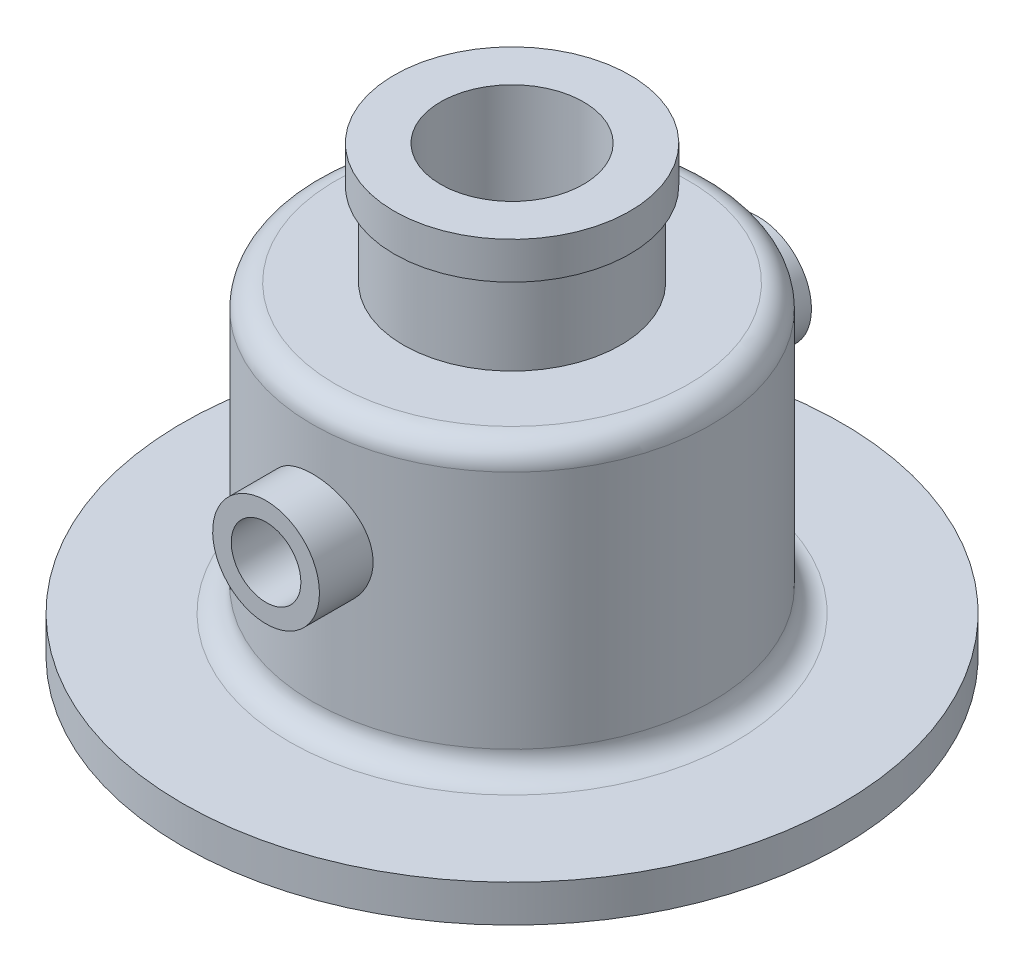
from build123d import *

# Parameters (mm, degrees)
BOSS_EXTRUDE1_START     = 35
SKETCH3_R               = 11.5
SKETCH3_R_2             = 7.5
BOSS_EXTRUDE1_DEPTH     = 18
BOSS_EXTRUDE2_START     = -53
SKETCH3_3_R             = 11.5
SKETCH3_3_R_2           = 7.5
BOSS_EXTRUDE2_DEPTH     = 18
CUT_EXTRUDE1_DEPTH      = 113.325965386
CUT_EXTRUDE1_DEPTH_BACK = 113.325965386
SKETCH3_4_R             = 7.5


with BuildPart() as part:
    # Sketch2 → Revolve1 (revolve)
    with BuildSketch(Plane.XY):
        with BuildLine():
            Line((32, -50.35), (32, -47.35))
            ThreePointArc((32, -47.35), (32.585786438, -45.935786438), (34, -45.35))
            Line((34, -45.35), (71, -45.35))
            Line((71, -45.35), (71, -37.35))
            Line((71, -37.35), (48, -37.35))
            ThreePointArc((48, -37.35), (44.464466094, -35.885533906), (43, -32.35))
            Line((43, -32.35), (43, 19.35))
            ThreePointArc((43, 19.35), (41.535533906, 22.885533906), (38, 24.35))
            Line((38, 24.35), (23.4, 24.35))
            Line((23.4, 24.35), (23.4, 42.35))
            Line((23.4, 42.35), (25.4, 42.35))
            Line((25.4, 42.35), (25.4, 50.35))
            Line((25.4, 50.35), (15.4, 50.35))
            Line((15.4, 50.35), (15.4, 16.197741963))
            Line((15.4, 16.197741963), (17.4, 13.774308272))
            Line((17.4, 13.774308272), (25.4, 13.774308272))
            Line((25.4, 13.774308272), (25.4, 17.62741804))
            Line((25.4, 17.62741804), (30, 17.62741804))
            ThreePointArc((30, 17.62741804), (33.535533906, 16.162951946), (35, 12.62741804))
            Line((35, 12.62741804), (35, -32.35))
            ThreePointArc((35, -32.35), (33.535533906, -35.885533906), (30, -37.35))
            Line((30, -37.35), (24, -37.35))
            Line((24, -37.35), (24, -50.35))
            Line((24, -50.35), (32, -50.35))
        make_face()
    revolve(axis=Axis((0, 50.35, 0), (0, -1, 0)))

    # Sketch3 → Boss-Extrude1 (add)
    with BuildSketch(Plane.XY.offset(BOSS_EXTRUDE1_START)):
        with Locations((0, -1.35)):
            Circle(SKETCH3_R)
        with Locations((0, -1.35)):
            Circle(SKETCH3_R_2, mode=Mode.SUBTRACT)
    extrude(amount=BOSS_EXTRUDE1_DEPTH)

    # Sketch3<3> → Boss-Extrude2 (add)
    with BuildSketch(Plane.XY.offset(BOSS_EXTRUDE2_START)):
        with Locations((0, -1.35)):
            Circle(SKETCH3_3_R)
        with Locations((0, -1.35)):
            Circle(SKETCH3_3_R_2, mode=Mode.SUBTRACT)
    extrude(amount=BOSS_EXTRUDE2_DEPTH)

    # Sketch3<4> → Cut-Extrude1 (cut, two sides: drawn at the far end of the back side and taken through both)
    with BuildSketch(Plane.XY.offset(-CUT_EXTRUDE1_DEPTH_BACK)):
        with Locations((0, -1.35)):
            Circle(SKETCH3_4_R)
    extrude(amount=CUT_EXTRUDE1_DEPTH + CUT_EXTRUDE1_DEPTH_BACK, mode=Mode.SUBTRACT)


solid = part.part
